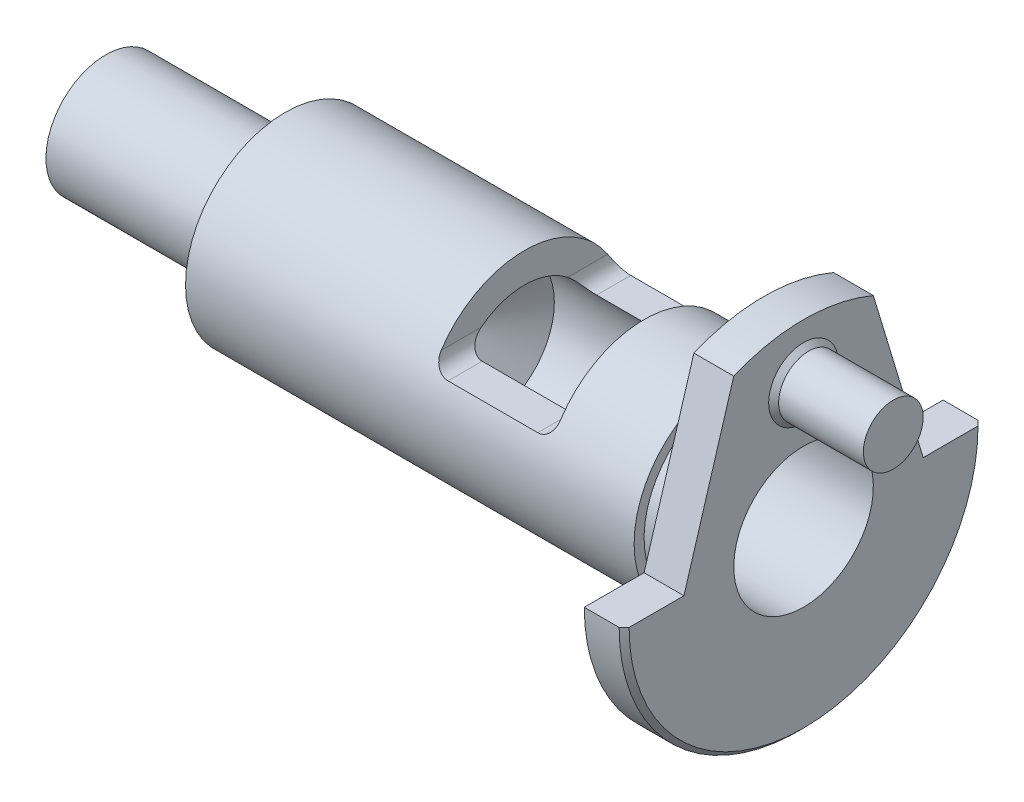
from build123d import *

# Parameters (mm, degrees)
ENL_V_MAT_EXTRU_1_DEPTH      = 750.28036314
ENL_V_MAT_EXTRU_1_DEPTH_BACK = 750.28036314
ENL_V_MAT_EXTRU_2_DEPTH      = 745.848977981
ESQUISSE5_R                  = 30
BOSS_EXTRU_1_DEPTH           = 90
CHANFREIN2_SIZE              = 5


with BuildPart() as part:
    # Esquisse1 → Révolution1 (revolve)
    with BuildSketch(Plane.XY, mode=Mode.PRIVATE) as r_volution1_sk:
        Polygon((4.713461336, 0), (344.713461336, 0), (384.713461336, 70), (704.713461336, 70), (704.713461336, 180), (664.713461336, 180), (664.713461336, 90), (634.713461336, 90), (634.713461336, 100), (184.713461336, 100), (184.713461336, 60), (4.713461336, 60), align=None)
    revolve(r_volution1_sk.sketch.rotate(Axis((4.713461336, 0, 0), (1, 0, 0)), 180), axis=Axis((4.713461336, 0, 0), (1, 0, 0)))

    # Esquisse2 → Enlèv. mat.-Extru.1 (cut, two sides: drawn at the far end of the back side and taken through both)
    with BuildSketch(Plane.XY.offset(-ENL_V_MAT_EXTRU_1_DEPTH_BACK)):
        with BuildLine():
            Line((424.713461336, 100), (544.713461336, 100))
            Line((544.713461336, 100), (544.713461336, 55))
            ThreePointArc((544.713461336, 55), (540.320063053, 44.393398282), (529.713461336, 40))
            Line((529.713461336, 40), (439.713461336, 40))
            ThreePointArc((439.713461336, 40), (429.106859618, 44.393398282), (424.713461336, 55))
            Line((424.713461336, 55), (424.713461336, 100))
        make_face()
    extrude(amount=ENL_V_MAT_EXTRU_1_DEPTH + ENL_V_MAT_EXTRU_1_DEPTH_BACK, mode=Mode.SUBTRACT)

    # Esquisse4 → Enlèv. mat.-Extru.2 (cut, through all)
    with BuildSketch(Plane(origin=(704.713461336, 0, 0), x_dir=(0, 0, -1), z_dir=(1, 0, 0))):
        with BuildLine():
            Line((-120, 0), (-70, 165.831239518))
            ThreePointArc((-70, 165.831239518), (-150, 99.498743711), (-180, 0))
            Line((-180, 0), (-120, 0))
        make_face()
        with BuildLine():
            ThreePointArc((180, 0), (150, 99.498743711), (70, 165.831239518))
            Line((70, 165.831239518), (120, 0))
            Line((120, 0), (180, 0))
        make_face()
    extrude(amount=-ENL_V_MAT_EXTRU_2_DEPTH, mode=Mode.SUBTRACT)

    # Esquisse5 → Boss.-Extru.1 (add)
    with BuildSketch(Plane(origin=(704.713461336, 0, 0), x_dir=(0, 0, -1), z_dir=(1, 0, 0))):
        with Locations(Location((0, 125, 0), (0, 0, 270))):
            Circle(ESQUISSE5_R)
    extrude(amount=BOSS_EXTRU_1_DEPTH)

    # Chanfrein2
    chanfrein2_edges = [part.edges().sort_by_distance(p)[0] for p in [
        (704.713461336, 155, 0),
        (704.713461336, -180, 0),
    ]]
    chamfer(chanfrein2_edges, length=CHANFREIN2_SIZE)


solid = part.part
